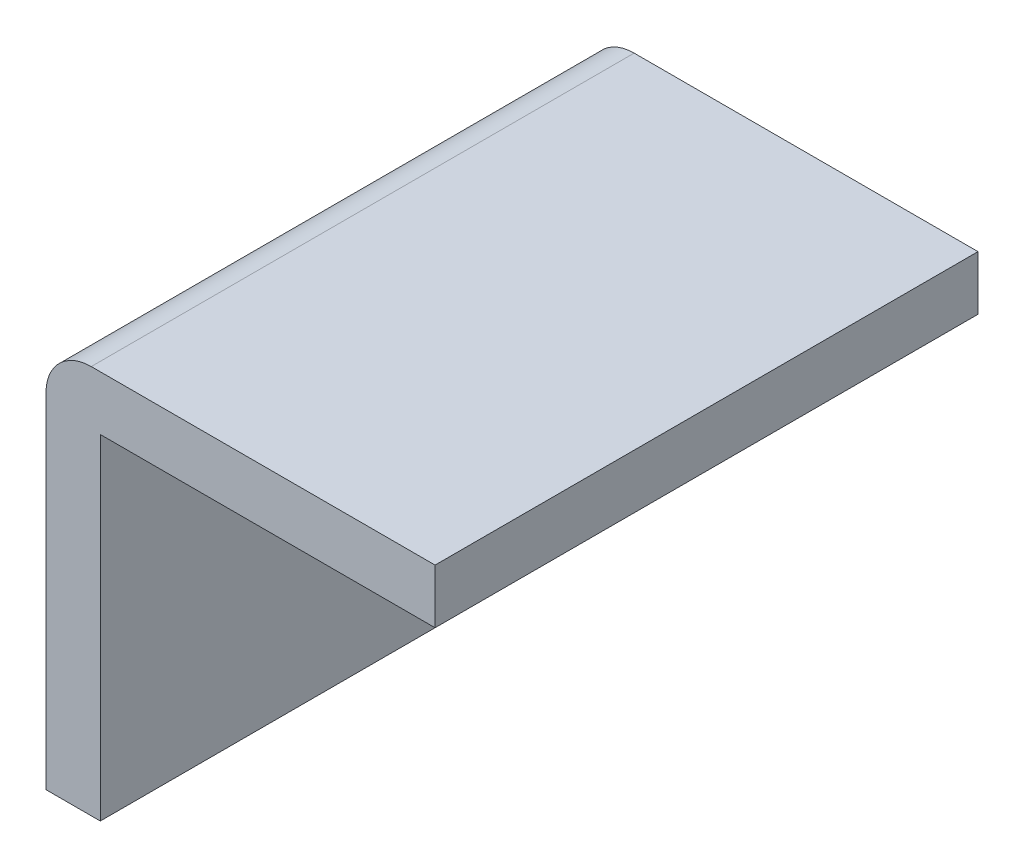
from build123d import *

# Parameters (mm, degrees)
BOSS_EXTRUDE1_DEPTH = 30


with BuildPart() as part:
    # Sketch1 → Boss-Extrude1 (new body)
    with BuildSketch(Plane.XY):
        with BuildLine():
            Line((0, 19), (0, 0))
            Line((0, 0), (1.5, 0))
            Line((1.5, 0), (1.5, 18.5))
            Line((1.5, 18.5), (20, 18.5))
            Line((20, 18.5), (20, 20))
            Line((20, 20), (1, 20))
            ThreePointArc((1, 20), (0.292893219, 19.707106781), (0, 19))
        make_face()
        with BuildLine():
            Line((-1.5, 0), (0, 0))
            Line((0, 0), (0, 19))
            ThreePointArc((0, 19), (0.292893219, 19.707106781), (1, 20))
            Line((1, 20), (20, 20))
            Line((20, 20), (20, 21.5))
            Line((20, 21.5), (1, 21.5))
            ThreePointArc((1, 21.5), (-0.767766953, 20.767766953), (-1.5, 19))
            Line((-1.5, 19), (-1.5, 0))
        make_face()
    extrude(amount=BOSS_EXTRUDE1_DEPTH)


solid = part.part
